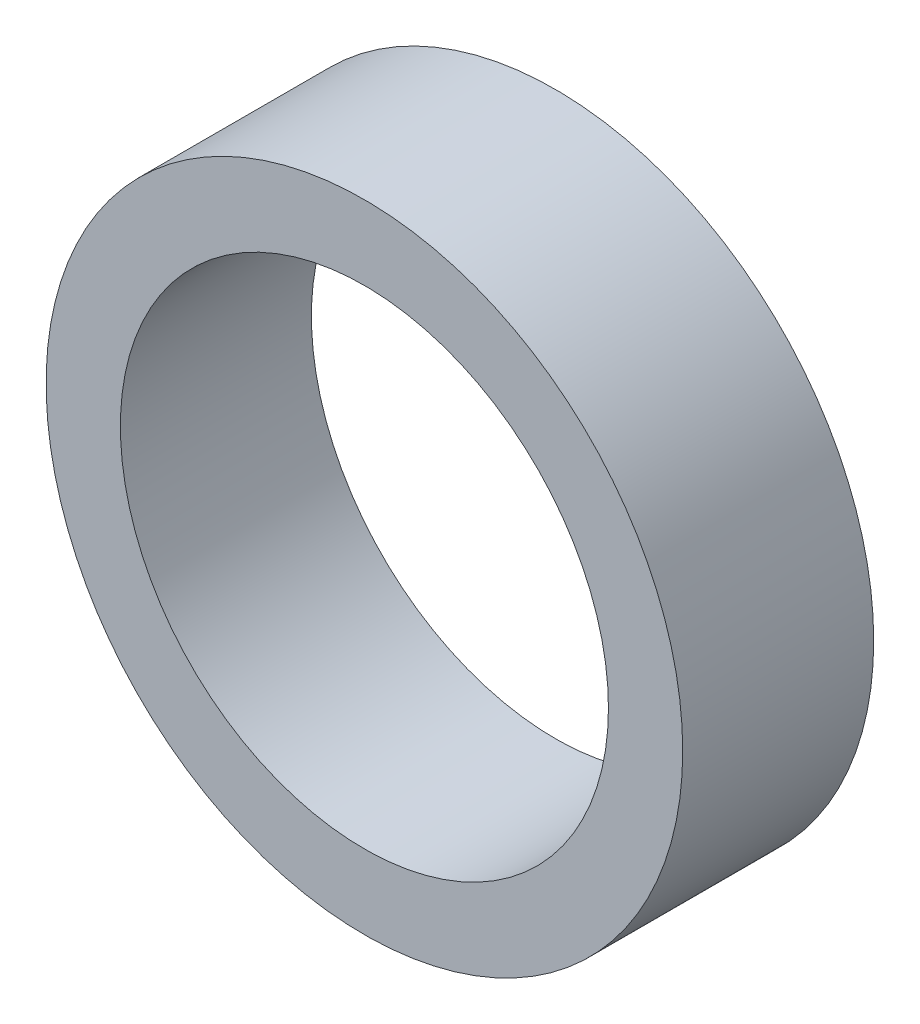
from build123d import *

# Parameters (mm, degrees)
SKETCH_1_R      = 30
SKETCH_1_R_2    = 23
EXTRUDE_1_DEPTH = 18


with BuildPart() as part:
    # 草图1 → 凸台-拉伸1 (new body)
    with BuildSketch(Plane.XY):
        Circle(SKETCH_1_R)
        Circle(SKETCH_1_R_2, mode=Mode.SUBTRACT)
    extrude(amount=EXTRUDE_1_DEPTH)


solid = part.part
